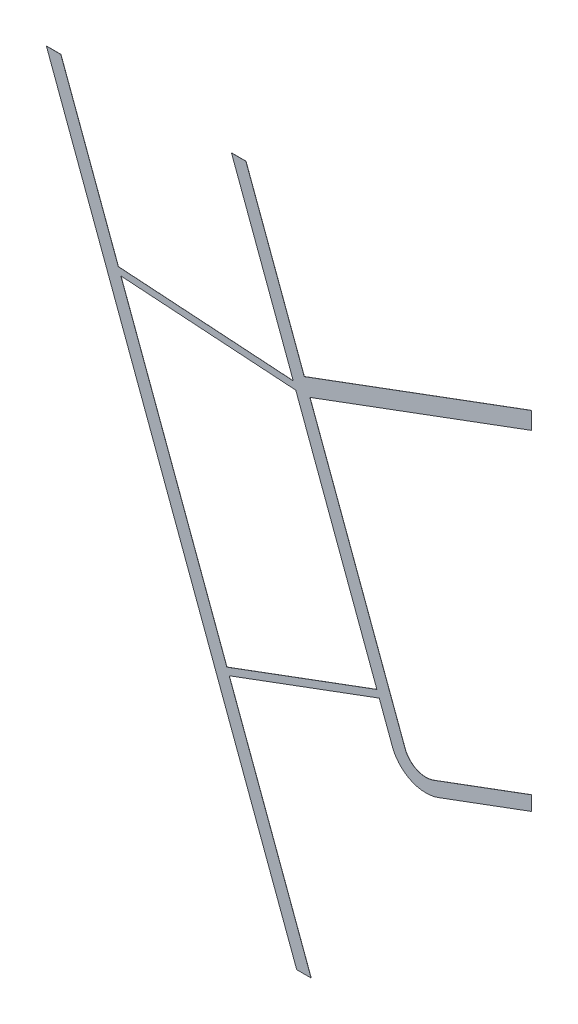
from build123d import *

# Parameters (mm, degrees)
BOSS_EXTRUDE1_DEPTH = 100
BOSS_EXTRUDE1_DRAFT = 1


with BuildPart() as part:
    # Sketch2 → Boss-Extrude1 (with draft: the straight prism first)
    with BuildSketch(Plane.XY):
        with BuildLine():
            Line((-109445.109958414, 250000), (76038.761009331, -250000))
            Line((76038.761009331, -250000), (86704.674310857, -250000))
            Line((86704.674310857, -250000), (26009.073390173, -86385.771431203))
            Line((26009.073390173, -86385.771431203), (137202.031954441, -45136.770673489))
            Line((137202.031954441, -45136.770673489), (146955.445625558, -71428.581439109))
            ThreePointArc((146955.445625558, -71428.581439109), (160747.652847111, -86295.082195084), (181012.419598066, -87054.722438259))
            Line((181012.419598066, -87054.722438259), (250000, -61462.555514961))
            Line((250000, -61462.555514961), (250000, -50787.751916435))
            Line((250000, -50787.751916435), (177523.637472943, -77674.144466796))
            ThreePointArc((177523.637472943, -77674.144466796), (164913.542670162, -77201.445441923), (156331.107809657, -67950.513209524))
            Line((156331.107809657, -67950.513209524), (85803.078601765, 122168.522046532))
            Line((85803.078601765, 122168.522046532), (250000, 183080.283210395))
            Line((250000, 183080.283210395), (250000, 195879.379172226))
            Line((250000, 195879.379172226), (81629.396726262, 133419.316667451))
            Line((81629.396726262, 133419.316667451), (38381.72387709, 250000))
            Line((38381.72387709, 250000), (27715.810575564, 250000))
            Line((27715.810575564, 250000), (73507.460404044, 126561.639592795))
            Line((73507.460404044, 126561.639592795), (-56148.576586816, 135082.67633285))
            Line((-56148.576586816, 135082.67633285), (-98779.196656888, 250000))
            Line((-98779.196656888, 250000), (-109445.109958414, 250000))
        make_face()
        Polygon((-54293.737877138, 130082.67633285), (75362.299113722, 121561.639592795), (135462.997839648, -40448.93958144), (24270.039275381, -81697.940339153), align=None, mode=Mode.SUBTRACT)
    extrude(amount=BOSS_EXTRUDE1_DEPTH)
    # Boss-Extrude1: the draft: its side faces are tilted about the plane it starts from
    boss_extrude1_sides = [part.faces().sort_by_distance(p)[0] for p in [
        (-16703.174474542, 0, 50),
        (81371.717660094, -250000, 50),
        (56356.873850515, -168192.885715601, 50),
        (81605.552672307, -65761.271052346, 50),
        (142078.73879, -58282.676056299, 50),
        (160747.652847111, -86295.082195084, 50),
        (215506.209799033, -74258.63897661, 50),
        (250000, -56125.153715698, 50),
        (213761.818736472, -64230.948191616, 50),
        (164913.542670162, -77201.445441923, 50),
        (121067.093205711, 27109.004418504, 50),
        (167901.539300882, 152624.402628463, 50),
        (250000, 189479.83119131, 50),
        (165814.698363131, 164649.347919839, 50),
        (60005.560301676, 191709.658333726, 50),
        (33048.767226327, 250000, 50),
        (50611.635489804, 188280.819796397, 50),
        (8679.441908614, 130822.157962822, 50),
        (-77463.886621852, 192541.338166425, 50),
        (-104112.153307651, 250000, 50),
        (10534.280618292, 125822.157962822, 50),
        (105412.648476685, 40556.350005678, 50),
        (79866.518557515, -61073.439960296, 50),
        (-15011.849300879, 24192.367996849, 50),
    ]]
    draft(boss_extrude1_sides, Plane.XY, BOSS_EXTRUDE1_DRAFT)


solid = part.part
